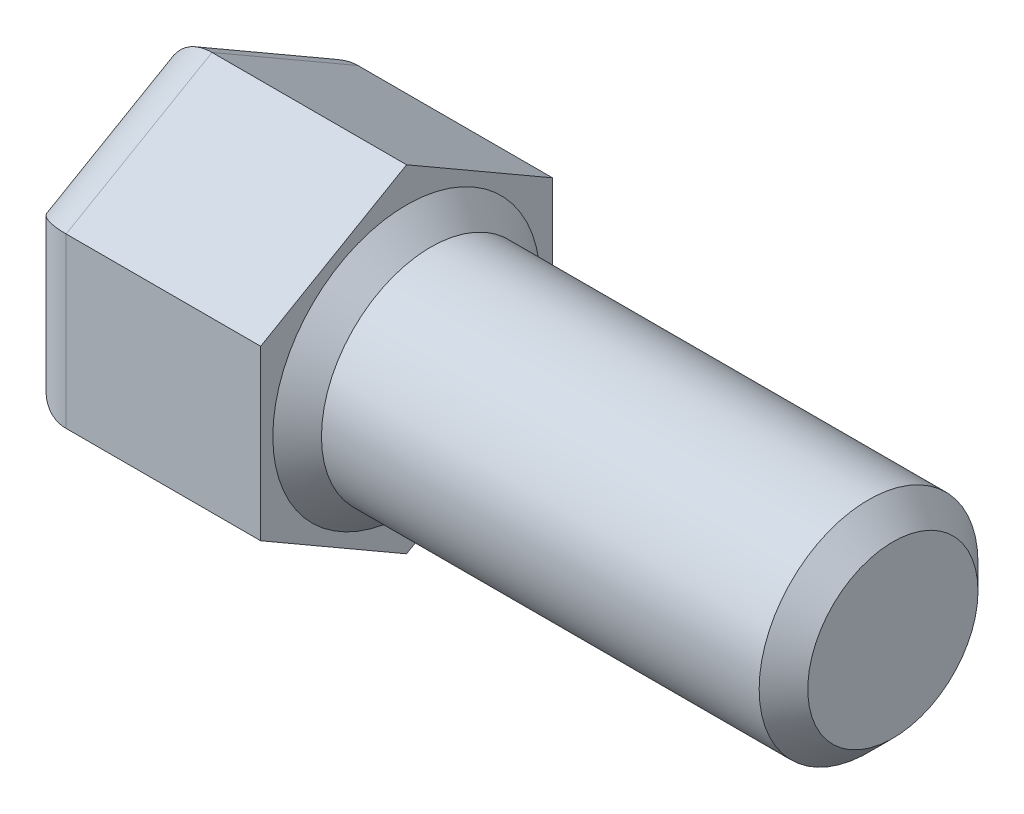
from build123d import *

# Parameters (mm, degrees)
EXTRUDE_1_DEPTH = 10
SKETCH_2_R      = 4.5
EXTRUDE_2_DEPTH = 20
FILLET_1_R      = 2
CHAMFER_1_SIZE  = 1


with BuildPart() as part:
    # 草圖1 → 擠出1 (new body)
    with BuildSketch(Plane.YZ):
        Polygon((6.92820323, 0), (3.464101615, -6), (-3.464101615, -6), (-6.92820323, 0), (-3.464101615, 6), (3.464101615, 6), align=None)
    extrude(amount=EXTRUDE_1_DEPTH)

    # 草圖2 → 擠出2 (add)
    with BuildSketch(Plane(origin=(10, 0, 0), x_dir=(0, 0, -1), z_dir=(1, 0, 0))):
        Circle(SKETCH_2_R)
    extrude(amount=EXTRUDE_2_DEPTH)

    # 圓角1
    fillet_1_edges = [part.edges().sort_by_distance(p)[0] for p in [
        (0, 5.196152423, -3),
        (0, 0, -6),
        (0, -5.196152423, -3),
        (0, -5.196152423, 3),
        (0, 0, 6),
        (0, 5.196152423, 3),
    ]]
    fillet(fillet_1_edges, radius=FILLET_1_R)

    # 倒角1
    chamfer_1_edges = [part.edges().sort_by_distance(p)[0] for p in [
        (10, 0, 4.5),
        (30, 0, 4.5),
    ]]
    chamfer(chamfer_1_edges, length=CHAMFER_1_SIZE)


solid = part.part
